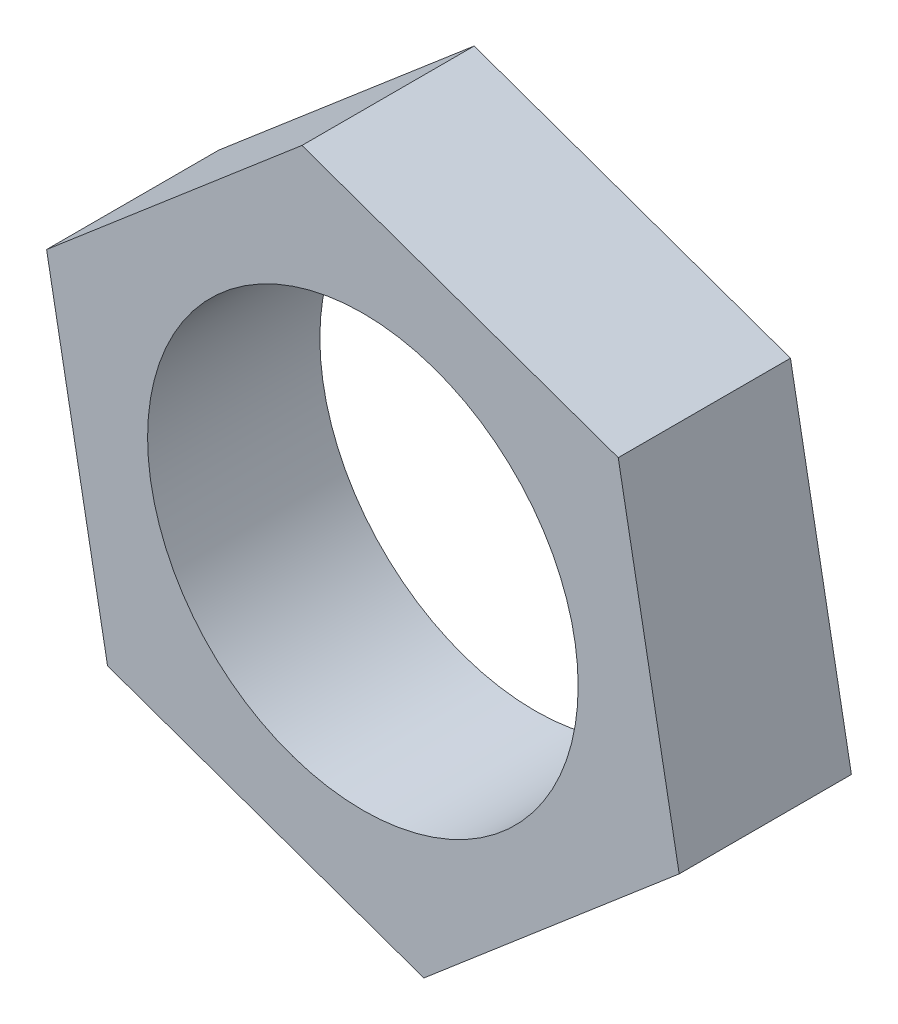
from build123d import *

# Parameters (mm, degrees)
SKETCH_1_R      = 10
EXTRUDE_1_DEPTH = 8


with BuildPart() as part:
    # 草图1 → 拉伸1 (new body)
    with BuildSketch(Plane.XY):
        Polygon((14.690994639, -5.212933581), (11.860030229, 10.116307773), (-2.83096441, 15.329241355), (-14.690994639, 5.212933581), (-11.860030229, -10.116307773), (2.83096441, -15.329241355), align=None)
        Circle(SKETCH_1_R, mode=Mode.SUBTRACT)
    extrude(amount=EXTRUDE_1_DEPTH)


solid = part.part
